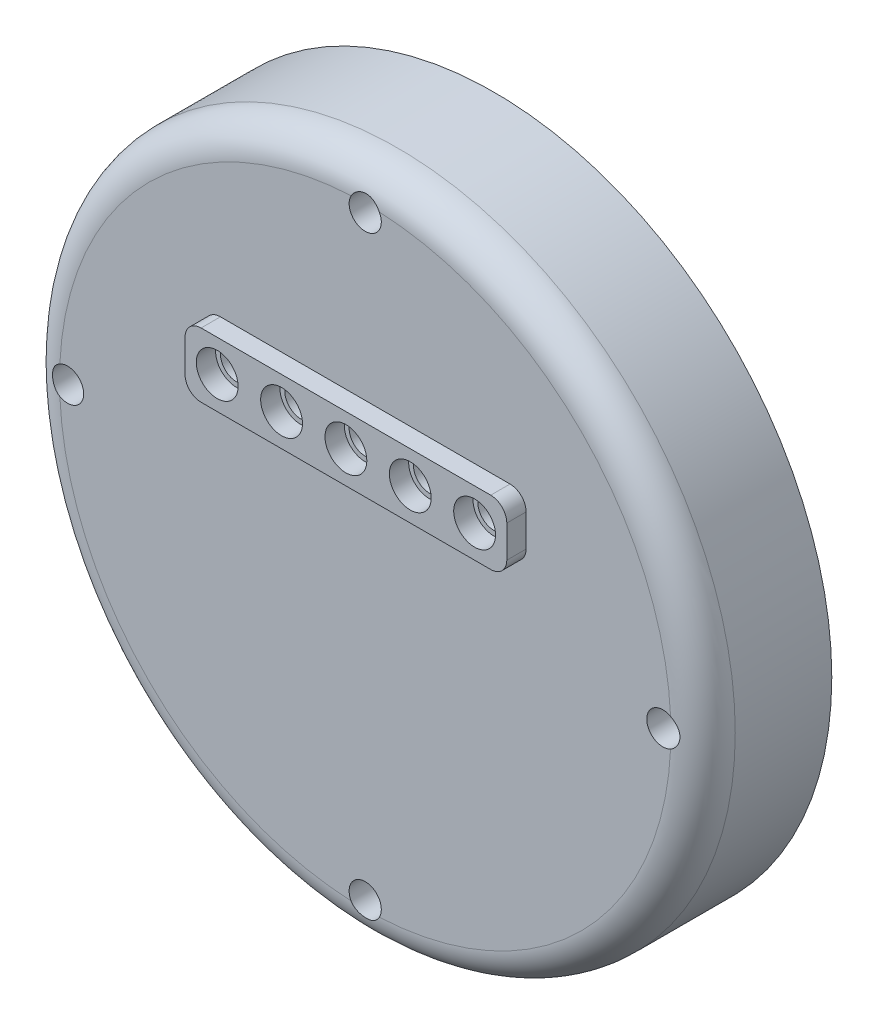
from build123d import *

# Parameters (mm, degrees)
SKETCH1_R           = 52.5
BOSS_EXTRUDE1_DEPTH = 20
SKETCH2_R           = 42.5
SKETCH2_R_2         = 40
CUT_EXTRUDE1_DEPTH  = 7
FILLET1_R           = 5
SKETCH3_W           = 40
SKETCH3_H           = 3
SKETCH3_W_2         = 60
CUT_EXTRUDE2_DEPTH  = 10
SKETCH4_R           = 2.5
CUT_EXTRUDE3_DEPTH  = 5
SKETCH5_R           = 1.5
CUT_EXTRUDE4_DEPTH  = 15
SKETCH8_R           = 1.5
CUT_EXTRUDE5_DEPTH  = 15
SKETCH7_R           = 1.5
CUT_EXTRUDE6_DEPTH  = 15
SKETCH6_R           = 1.5
CUT_EXTRUDE7_DEPTH  = 15
SKETCH9_W           = 3
SKETCH9_H           = 10
CUT_EXTRUDE8_DEPTH  = 10
SKETCH10_R          = 2.5
CUT_EXTRUDE9_DEPTH  = 20
SKETCH11_W          = 50
SKETCH11_H          = 10
SKETCH11_R          = 3.25
BOSS_EXTRUDE2_DEPTH = 3
FILLET2_R           = 2.5


with BuildPart() as part:
    # Sketch1 → Boss-Extrude1 (new body)
    with BuildSketch(Plane.XY):
        Circle(SKETCH1_R)
    extrude(amount=BOSS_EXTRUDE1_DEPTH)

    # Sketch2 → Cut-Extrude1 (cut)
    with BuildSketch(Plane(origin=(0, 0, 0), x_dir=(-1, 0, 0), z_dir=(0, 0, -1))):
        Circle(SKETCH2_R)
        Circle(SKETCH2_R_2, mode=Mode.SUBTRACT)
    extrude(amount=-CUT_EXTRUDE1_DEPTH, mode=Mode.SUBTRACT)

    # Fillet1
    fillet1_edges = [part.edges().sort_by_distance(p)[0] for p in [
        (-52.5, 0, 20),
    ]]
    fillet(fillet1_edges, radius=FILLET1_R)

    # Sketch3 → Cut-Extrude2 (cut)
    with BuildSketch(Plane(origin=(0, 0, 0), x_dir=(-1, 0, 0), z_dir=(0, 0, -1))):
        with Locations((0, -23.5)):
            Rectangle(SKETCH3_W, SKETCH3_H)
        with Locations((0, 4.5)):
            Rectangle(SKETCH3_W_2, SKETCH3_H)
    extrude(amount=-CUT_EXTRUDE2_DEPTH, mode=Mode.SUBTRACT)

    # Sketch4 → Cut-Extrude3 (cut)
    with BuildSketch(Plane.XY.offset(20)):
        with Locations((0, 46.25)):
            Circle(SKETCH4_R)
        with Locations((46.25, 0)):
            Circle(SKETCH4_R)
        with Locations((0, -46.25)):
            Circle(SKETCH4_R)
        with Locations((-46.25, 0)):
            Circle(SKETCH4_R)
    extrude(amount=-CUT_EXTRUDE3_DEPTH, mode=Mode.SUBTRACT)

    # Sketch5 → Cut-Extrude4 (cut)
    with BuildSketch(Plane.XY.offset(15)):
        with Locations((0, 46.25)):
            Circle(SKETCH5_R)
    extrude(amount=-CUT_EXTRUDE4_DEPTH, mode=Mode.SUBTRACT)

    # Sketch8 → Cut-Extrude5 (cut)
    with BuildSketch(Plane.XY.offset(15)):
        with Locations((-46.25, 0)):
            Circle(SKETCH8_R)
    extrude(amount=-CUT_EXTRUDE5_DEPTH, mode=Mode.SUBTRACT)

    # Sketch7 → Cut-Extrude6 (cut)
    with BuildSketch(Plane.XY.offset(15)):
        with Locations((0, -46.25)):
            Circle(SKETCH7_R)
    extrude(amount=-CUT_EXTRUDE6_DEPTH, mode=Mode.SUBTRACT)

    # Sketch6 → Cut-Extrude7 (cut)
    with BuildSketch(Plane.XY.offset(15)):
        with Locations((46.25, 0)):
            Circle(SKETCH6_R)
    extrude(amount=-CUT_EXTRUDE7_DEPTH, mode=Mode.SUBTRACT)

    # Sketch9 → Cut-Extrude8 (cut)
    with BuildSketch(Plane(origin=(0, 0, 0), x_dir=(-1, 0, 0), z_dir=(0, 0, -1))):
        with Locations((0, -30)):
            Rectangle(SKETCH9_W, SKETCH9_H)
    extrude(amount=-CUT_EXTRUDE8_DEPTH, mode=Mode.SUBTRACT)

    # Sketch10 → Cut-Extrude9 (cut)
    with BuildSketch(Plane(origin=(0, 0, 0), x_dir=(-1, 0, 0), z_dir=(0, 0, -1))):
        with Locations((-20, 16)):
            Circle(SKETCH10_R)
        with Locations((-10, 16)):
            Circle(SKETCH10_R)
        with Locations((0, 16)):
            Circle(SKETCH10_R)
        with Locations((10, 16)):
            Circle(SKETCH10_R)
        with Locations((20, 16)):
            Circle(SKETCH10_R)
    extrude(amount=-CUT_EXTRUDE9_DEPTH, mode=Mode.SUBTRACT)

    # Sketch11 → Boss-Extrude2 (add)
    with BuildSketch(Plane.XY.offset(20)):
        with Locations((0, 16)):
            Rectangle(SKETCH11_W, SKETCH11_H)
        with Locations((-20, 16)):
            Circle(SKETCH11_R, mode=Mode.SUBTRACT)
        with Locations((-10, 16)):
            Circle(SKETCH11_R, mode=Mode.SUBTRACT)
        with Locations((0, 16)):
            Circle(SKETCH11_R, mode=Mode.SUBTRACT)
        with Locations((10, 16)):
            Circle(SKETCH11_R, mode=Mode.SUBTRACT)
        with Locations((20, 16)):
            Circle(SKETCH11_R, mode=Mode.SUBTRACT)
    extrude(amount=BOSS_EXTRUDE2_DEPTH)

    # Fillet2
    fillet2_edges = [part.edges().sort_by_distance(p)[0] for p in [
        (25, 11, 21.5),
        (25, 21, 21.5),
        (-25, 21, 21.5),
        (-25, 11, 21.5),
    ]]
    fillet(fillet2_edges, radius=FILLET2_R)


solid = part.part
